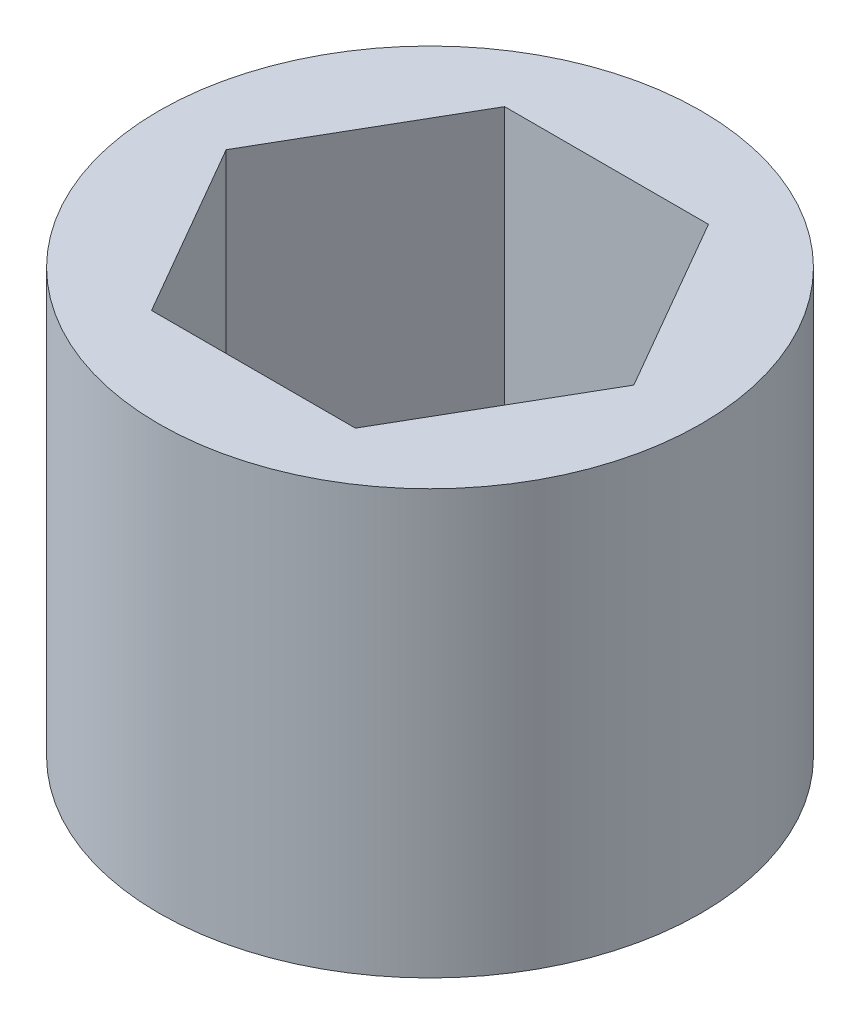
from build123d import *

# Parameters (mm, degrees)
SKETCH1_R           = 9.7536
BOSS_EXTRUDE1_DEPTH = 15.24


with BuildPart() as part:
    # Sketch1 → Boss-Extrude1 (new body)
    with BuildSketch(Plane(origin=(0, 0, 0), x_dir=(1, 0, 0), z_dir=(0, 1, 0))):
        with Locations(Location((0, 0, 0), (0, 0, 90))):
            Circle(SKETCH1_R)
        Polygon((-3.666174209, 6.35), (-7.332348419, 0), (-3.666174209, -6.35), (3.666174209, -6.35), (7.332348419, 0), (3.666174209, 6.35), align=None, mode=Mode.SUBTRACT)
    extrude(amount=BOSS_EXTRUDE1_DEPTH)


solid = part.part
